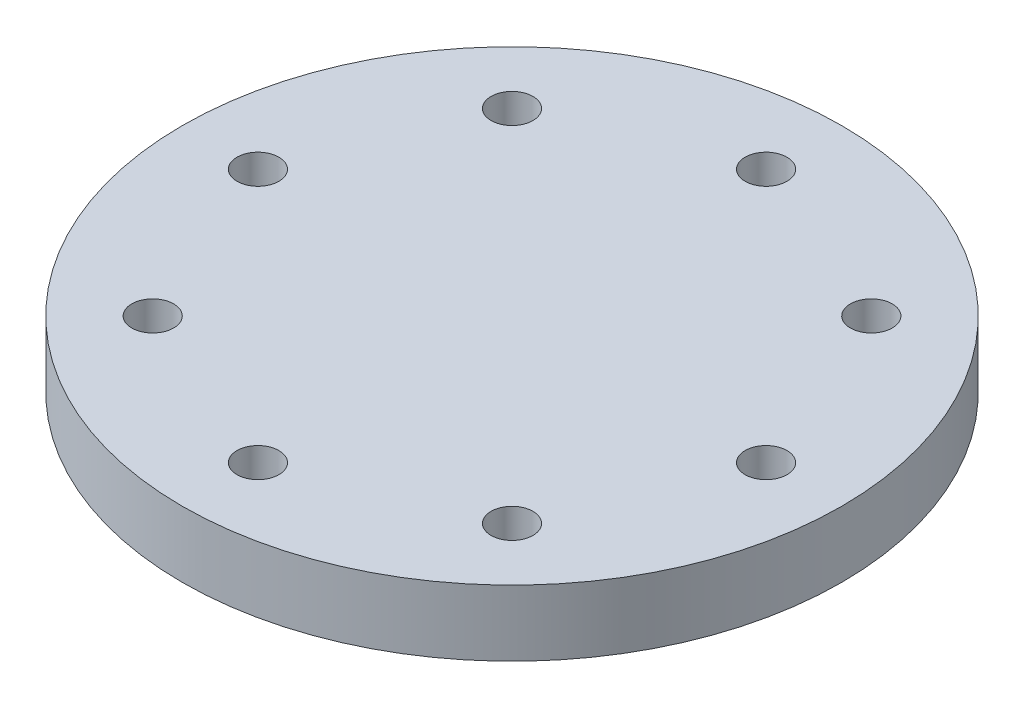
from build123d import *

# Parameters (mm, degrees)
SKETCH_1_R          = 50
SKETCH_1_R_2        = 3.175
EXTRUDE_1_DEPTH     = 10
EXTRUDE_START       = -25.5
EXTRUDE_2_DEPTH     = 25.5
SKETCH_4_R          = 3.175
CUT_EXTRUDE_1_DEPTH = 30
SKETCH_2_R          = 3.175
CUT_EXTRUDE_2_DEPTH = 30
EXTRUDE_3_DEPTH     = 10
EXTRUDE_4_DEPTH     = 10


with BuildPart() as part:
    # 草图1 → 凸台-拉伸1 (new body)
    with BuildSketch(Plane(origin=(0, 0, 0), x_dir=(1, 0, 0), z_dir=(0, 1, 0))):
        with Locations(Location((0, 0, 0), (0, 0, 270))):
            Circle(SKETCH_1_R)
        with BuildLine():
            Line((7, -2), (6.708203932, -2))
            ThreePointArc((6.708203932, -2), (-7, 0), (6.708203932, 2))
            Line((6.708203932, 2), (7, 2))
            Line((7, 2), (7, -2))
        make_face(mode=Mode.SUBTRACT)
        with Locations(Location((0, -38.530339059, 0), (0, 0, 270))):
            Circle(SKETCH_1_R_2, mode=Mode.SUBTRACT)
        with Locations(Location((0, 38.530339059, 0), (0, 0, 270))):
            Circle(SKETCH_1_R_2, mode=Mode.SUBTRACT)
        with Locations(Location((-38.530339059, 0, 0), (0, 0, 270))):
            Circle(SKETCH_1_R_2, mode=Mode.SUBTRACT)
        with Locations(Location((38.530339059, 0, 0), (0, 0, 270))):
            Circle(SKETCH_1_R_2, mode=Mode.SUBTRACT)
        with Locations(Location((-27.24506403, -27.24506403, 0), (0, 0, 270))):
            Circle(SKETCH_1_R_2, mode=Mode.SUBTRACT)
        with Locations(Location((27.24506403, -27.24506403, 0), (0, 0, 270))):
            Circle(SKETCH_1_R_2, mode=Mode.SUBTRACT)
        with Locations(Location((27.24506403, 27.24506403, 0), (0, 0, 270))):
            Circle(SKETCH_1_R_2, mode=Mode.SUBTRACT)
        with Locations(Location((-27.24506403, 27.24506403, 0), (0, 0, 270))):
            Circle(SKETCH_1_R_2, mode=Mode.SUBTRACT)
    extrude(amount=EXTRUDE_1_DEPTH)

    # 草图1<8> → 凸台-拉伸2 (add)
    with BuildSketch(Plane(origin=(0, 0, 0), x_dir=(1, 0, 0), z_dir=(0, 1, 0)).offset(EXTRUDE_START)):
        with BuildLine():
            Line((0, -11), (0, -7))
            ThreePointArc((0, -7), (-4.949747468, -4.949747468), (-7, 0))
            Line((-7, 0), (-11, 0))
            ThreePointArc((-11, 0), (-7.778174593, -7.778174593), (0, -11))
        make_face()
        with BuildLine():
            Line((-11, 0), (-7, 0))
            ThreePointArc((-7, 0), (-4.949747468, 4.949747468), (0, 7))
            Line((0, 7), (0, 11))
            ThreePointArc((0, 11), (-7.778174593, 7.778174593), (-11, 0))
        make_face()
        with BuildLine():
            Line((7, 2), (7, 0))
            Line((7, 0), (11, 0))
            ThreePointArc((11, 0), (7.778174593, 7.778174593), (0, 11))
            Line((0, 11), (0, 7))
            ThreePointArc((0, 7), (4.183300133, 5.61248608), (6.708203932, 2))
            Line((6.708203932, 2), (7, 2))
        make_face()
        with BuildLine():
            Line((7, -2), (6.708203932, -2))
            ThreePointArc((6.708203932, -2), (4.183300133, -5.61248608), (0, -7))
            Line((0, -7), (0, -11))
            ThreePointArc((0, -11), (7.778174593, -7.778174593), (11, 0))
            Line((11, 0), (7, 0))
            Line((7, 0), (7, -2))
        make_face()
    extrude(amount=EXTRUDE_2_DEPTH)

    # 草图4 → 切除-拉伸1 (cut)
    with BuildSketch(Plane(origin=(0, 0, 0), x_dir=(0, 0, -1), z_dir=(1, 0, 0))):
        with Locations((0, -8.219375354)):
            Circle(SKETCH_4_R)
        with Locations((0, -20.547213865)):
            Circle(SKETCH_4_R)
    extrude(amount=-CUT_EXTRUDE_1_DEPTH, mode=Mode.SUBTRACT)

    # 草图2 → 切除-拉伸2 (cut)
    with BuildSketch(Plane.XY):
        with Locations((0, -6.856583625)):
            Circle(SKETCH_2_R)
        with Locations((0, -19.346548073)):
            Circle(SKETCH_2_R)
    extrude(amount=-CUT_EXTRUDE_2_DEPTH, mode=Mode.SUBTRACT)

    # 草图1<9> → 凸台-拉伸3 (add)
    with BuildSketch(Plane(origin=(0, 0, 0), x_dir=(1, 0, 0), z_dir=(0, 1, 0))):
        with BuildLine():
            Line((6.708203932, -2), (0, -2))
            Line((0, -2), (0, 2))
            Line((0, 2), (6.708203932, 2))
            ThreePointArc((6.708203932, 2), (-7, 0), (6.708203932, -2))
        make_face()
    extrude(amount=EXTRUDE_3_DEPTH)

    # 草图1<10> → 凸台-拉伸4 (add)
    with BuildSketch(Plane(origin=(0, 0, 0), x_dir=(1, 0, 0), z_dir=(0, 1, 0))):
        with BuildLine():
            Line((0, 2), (0, 0))
            Line((0, 0), (7, 0))
            ThreePointArc((7, 0), (6.926666858, 1.010587075), (6.708203932, 2))
            Line((6.708203932, 2), (0, 2))
        make_face()
        with BuildLine():
            Line((0, 0), (0, -2))
            Line((0, -2), (6.708203932, -2))
            ThreePointArc((6.708203932, -2), (6.926666858, -1.010587075), (7, 0))
            Line((7, 0), (0, 0))
        make_face()
        with BuildLine():
            ThreePointArc((7, 0), (6.926666858, -1.010587075), (6.708203932, -2))
            Line((6.708203932, -2), (7, -2))
            Line((7, -2), (7, 0))
        make_face()
        with BuildLine():
            ThreePointArc((6.708203932, 2), (6.926666858, 1.010587075), (7, 0))
            Line((7, 0), (7, 2))
            Line((7, 2), (6.708203932, 2))
        make_face()
    extrude(amount=EXTRUDE_4_DEPTH)


solid = part.part
